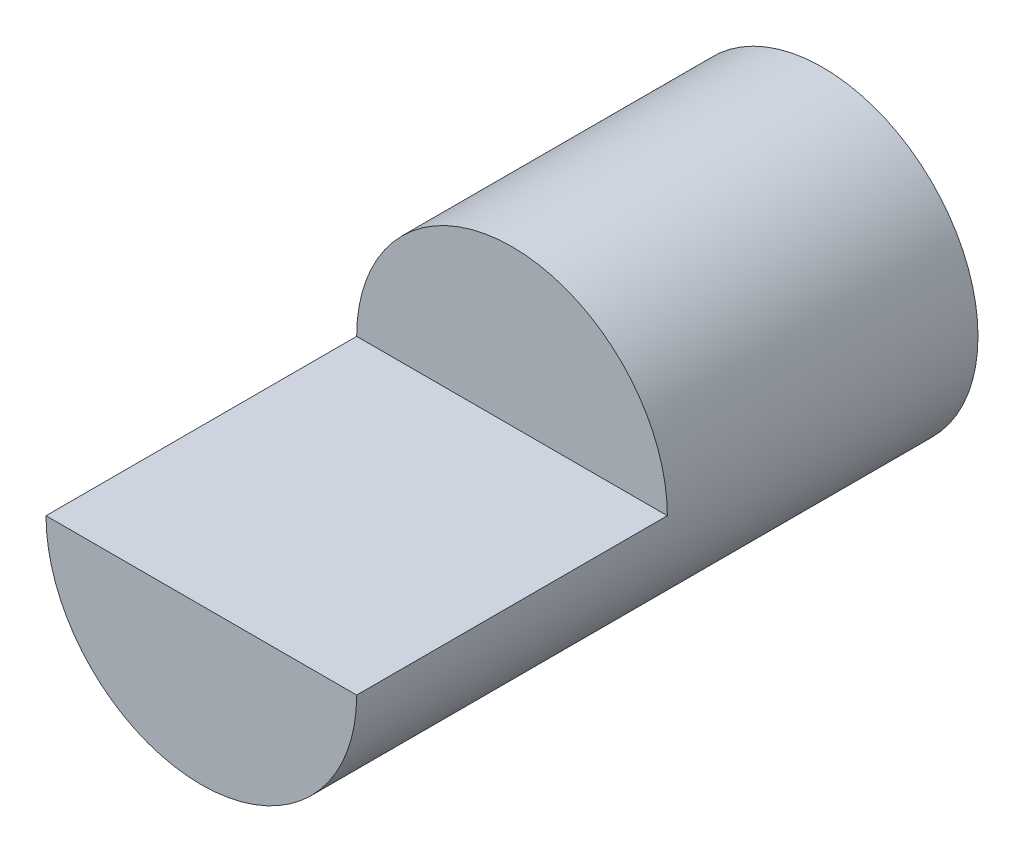
from build123d import *

# Parameters (mm, degrees)
SKETCH1_R           = 6.35
BOSS_EXTRUDE1_DEPTH = 12.7
BOSS_EXTRUDE2_DEPTH = 12.7


with BuildPart() as part:
    # Sketch1 → Boss-Extrude1 (new body)
    with BuildSketch(Plane.XY):
        Circle(SKETCH1_R)
    extrude(amount=BOSS_EXTRUDE1_DEPTH)

    # Sketch2 → Boss-Extrude2 (add)
    with BuildSketch(Plane.XY.offset(12.7)):
        with BuildLine():
            Line((6.35, 0), (-6.35, 0))
            ThreePointArc((-6.35, 0), (0, -6.35), (6.35, 0))
        make_face()
    extrude(amount=BOSS_EXTRUDE2_DEPTH)


solid = part.part
